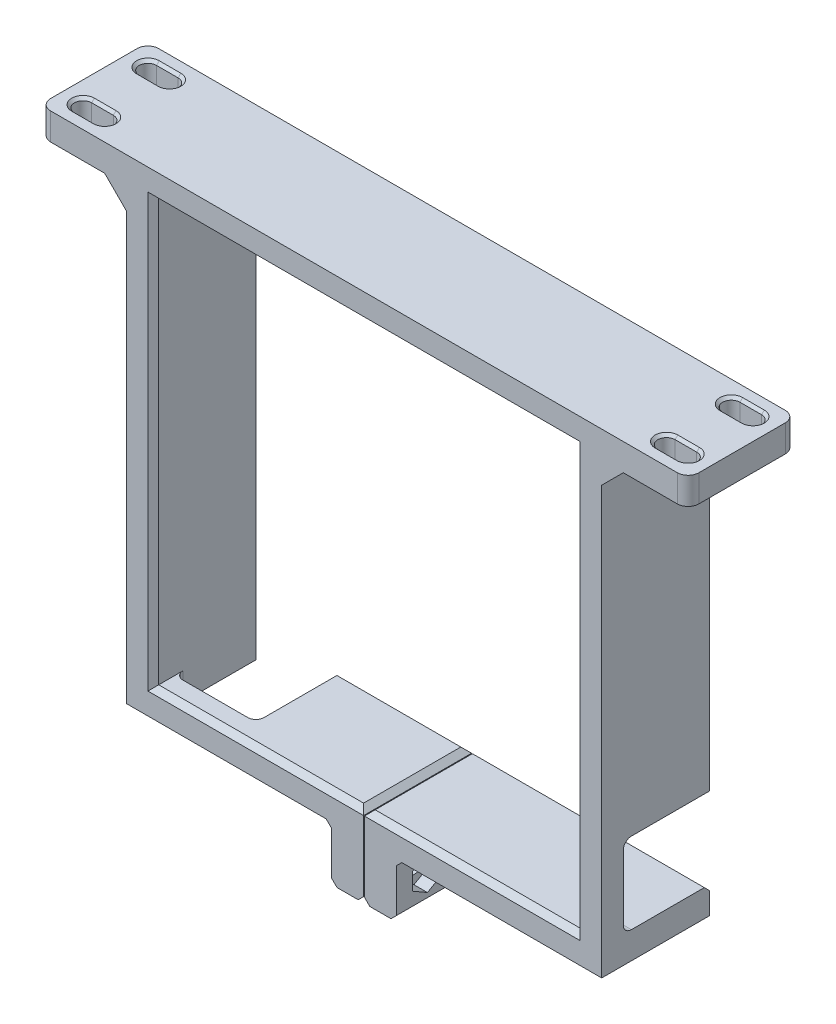
from build123d import *

# Parameters (mm, degrees)
SKETCH1_W            = 88.03
SKETCH1_H            = 88.03
SKETCH1_W_2          = 78.03
SKETCH1_H_2          = 78.03
BOSS_EXTRUDE1_DEPTH  = 20
SKETCH2_W            = 16
SKETCH2_H            = 15
CUT_EXTRUDE1_DEPTH   = 20
SKETCH5_W            = 12
SKETCH5_H            = 10
BOSS_EXTRUDE2_DEPTH  = 20
SKETCH3_W            = 0.15
SKETCH3_H            = 15
CUT_EXTRUDE2_DEPTH   = 73.490968058
CUT_EXTRUDE3_DEPTH   = 2.5
SKETCH7_R            = 1.55
CUT_EXTRUDE4_DEPTH   = 77.283159675
SKETCH8_W            = 16
SKETCH8_H            = 5
BOSS_EXTRUDE3_DEPTH  = 20
CUT_EXTRUDE5_DEPTH   = 117.669109558
FILLET8_R            = 2
FILLET8_OF_MIRROR9_R = 2
CHAMFER1_SIZE        = 4
SKETCH10_W           = 15
SKETCH10_H           = 16
CUT_EXTRUDE6_DEPTH   = 15
FILLET7_R            = 1.5
CHAMFER2_SIZE        = 1
CHAMFER3_SIZE        = 0.5


with BuildPart() as part:
    # Sketch1 → Boss-Extrude1 (new body)
    with BuildSketch(Plane.XY):
        Rectangle(SKETCH1_W, SKETCH1_H)
        Rectangle(SKETCH1_W_2, SKETCH1_H_2, mode=Mode.SUBTRACT)
    extrude(amount=BOSS_EXTRUDE1_DEPTH)

    # Sketch2 → Cut-Extrude1 (cut)
    with BuildSketch(Plane(origin=(44.015, 0, 0), x_dir=(0, 0, -1), z_dir=(1, 0, 0))):
        with Locations((-8, -31.515)):
            Rectangle(SKETCH2_W, SKETCH2_H)
    extrude(amount=-CUT_EXTRUDE1_DEPTH, mode=Mode.SUBTRACT)

    # Sketch5 → Boss-Extrude2 (add)
    with BuildSketch(Plane(origin=(0, 0, 0), x_dir=(-1, 0, 0), z_dir=(0, 0, -1))):
        with Locations((0, -49.015)):
            Rectangle(SKETCH5_W, SKETCH5_H)
    extrude(amount=-BOSS_EXTRUDE2_DEPTH)

    # Sketch3 → Cut-Extrude2 (cut, through all)
    with BuildSketch(Plane(origin=(0, 0, 0), x_dir=(-1, 0, 0), z_dir=(0, 0, -1))):
        with Locations((0, -46.515)):
            Rectangle(SKETCH3_W, SKETCH3_H)
    extrude(amount=-CUT_EXTRUDE2_DEPTH, mode=Mode.SUBTRACT)

    # Sketch6 → Cut-Extrude3 (cut)
    with BuildSketch(Plane.ZY.offset(6)):
        Polygon((8.5, -47.42728676), (5.75, -45.839573519), (3, -47.42728676), (3, -50.60271324), (5.75, -52.190426481), (8.5, -50.60271324), align=None)
        Polygon((17, -47.42728676), (14.25, -45.839573519), (11.5, -47.42728676), (11.5, -50.60271324), (14.25, -52.190426481), (17, -50.60271324), align=None)
    cut_extrude3 = extrude(amount=-CUT_EXTRUDE3_DEPTH, mode=Mode.SUBTRACT)

    # Sketch7 → Cut-Extrude4 (cut, symmetric)
    with BuildSketch(Plane.ZY.offset(6)):
        with Locations(Location((5.75, -49.015, 0), (0, 0, 270))):
            Circle(SKETCH7_R)
        with Locations(Location((14.25, -49.015, 0), (0, 0, 270))):
            Circle(SKETCH7_R)
    cut_extrude4 = extrude(amount=CUT_EXTRUDE4_DEPTH, both=True, mode=Mode.SUBTRACT)

    # Sketch8 → Boss-Extrude3 (add)
    with BuildSketch(Plane(origin=(0, 0, 0), x_dir=(-1, 0, 0), z_dir=(0, 0, -1))):
        with Locations((-52.015, 41.515)):
            Rectangle(SKETCH8_W, SKETCH8_H)
    boss_extrude3 = extrude(amount=-BOSS_EXTRUDE3_DEPTH)

    # Sketch9 → Cut-Extrude5 (cut, through all)
    with BuildSketch(Plane(origin=(0, 44.015, 0), x_dir=(1, 0, 0), z_dir=(0, 1, 0))):
        with BuildLine():
            Line((52.015, -14.4), (56.015, -14.4))
            ThreePointArc((56.015, -14.4), (57.615, -16), (56.015, -17.6))
            Line((56.015, -17.6), (52.015, -17.6))
            ThreePointArc((52.015, -17.6), (50.415, -16), (52.015, -14.4))
        make_face()
        with BuildLine():
            Line((52.015, -2.4), (56.015, -2.4))
            ThreePointArc((56.015, -2.4), (57.615, -4), (56.015, -5.6))
            Line((56.015, -5.6), (52.015, -5.6))
            ThreePointArc((52.015, -5.6), (50.415, -4), (52.015, -2.4))
        make_face()
    cut_extrude5 = extrude(amount=-CUT_EXTRUDE5_DEPTH, mode=Mode.SUBTRACT)

    # Fillet8
    fillet8_edges = [part.edges().sort_by_distance(p)[0] for p in [
        (60.015, 41.515, 0),
        (60.015, 41.515, 20),
    ]]
    fillet(fillet8_edges, radius=FILLET8_R)

    # Mirror9: Cut-Extrude3, Cut-Extrude4, Boss-Extrude3, Cut-Extrude5 across plane
    add(cut_extrude3.mirror(Plane(origin=(0, 0, 0), x_dir=(0, 0, 1), z_dir=(1, 0, 0))), mode=Mode.SUBTRACT)
    add(cut_extrude4.mirror(Plane(origin=(0, 0, 0), x_dir=(0, 0, 1), z_dir=(1, 0, 0))), mode=Mode.SUBTRACT)
    add(boss_extrude3.mirror(Plane(origin=(0, 0, 0), x_dir=(0, 0, 1), z_dir=(1, 0, 0))))
    add(cut_extrude5.mirror(Plane(origin=(0, 0, 0), x_dir=(0, 0, 1), z_dir=(1, 0, 0))), mode=Mode.SUBTRACT)

    # Fillet8 of Mirror9
    fillet8_of_mirror9_edges = [part.edges().sort_by_distance(p)[0] for p in [
        (-60.015, 41.515, 0),
        (-60.015, 41.515, 20),
    ]]
    fillet(fillet8_of_mirror9_edges, radius=FILLET8_OF_MIRROR9_R)

    # Chamfer1
    chamfer1_edges = [part.edges().sort_by_distance(p)[0] for p in [
        (44.015, 39.015, 10),
        (-44.015, 39.015, 10),
    ]]
    chamfer(chamfer1_edges, length=CHAMFER1_SIZE)

    # Sketch10 → Cut-Extrude6 (cut)
    with BuildSketch(Plane.XZ.offset(44.015)):
        with Locations((-31.515, 8)):
            Rectangle(SKETCH10_W, SKETCH10_H)
    extrude(amount=-CUT_EXTRUDE6_DEPTH, mode=Mode.SUBTRACT)

    # Fillet7
    fillet7_edges = [part.edges().sort_by_distance(p)[0] for p in [
        (-39.015, -41.515, 16),
        (-24.015, -41.515, 16),
        (41.515, -39.015, 16),
        (41.515, -24.015, 16),
    ]]
    fillet(fillet7_edges, radius=FILLET7_R)

    # Chamfer2
    chamfer2_edges = [part.edges().sort_by_distance(p)[0] for p in [
        (0, 39.015, 0),
        (-39.015, -2.5, 0),
        (39.015, 0, 20),
        (0, 39.015, 20),
        (-39.015, 0, 20),
        (-19.545, -39.015, 20),
        (39.015, 7.5, 0),
        (-12.045, -39.015, 0),
        (-6, -54.015, 10),
        (-6, -44.015, 10),
        (6, -44.015, 10),
        (6, -54.015, 10),
        (22.045, -39.015, 0),
        (19.545, -39.015, 20),
        (0.075, -54.015, 10),
        (0.075, -39.015, 10),
        (-0.075, -39.015, 10),
        (-0.075, -54.015, 10),
    ]]
    chamfer(chamfer2_edges, length=CHAMFER2_SIZE)

    # Chamfer3
    chamfer3_edges = [part.edges().sort_by_distance(p)[0] for p in [
        (54.015, 39.015, 5.6),
        (57.615, 39.015, 4),
        (54.015, 39.015, 2.4),
        (50.415, 39.015, 4),
        (54.015, 39.015, 17.6),
        (57.615, 39.015, 16),
        (54.015, 39.015, 14.4),
        (50.415, 39.015, 16),
        (50.415, 44.015, 16),
        (54.015, 44.015, 17.6),
        (57.615, 44.015, 16),
        (54.015, 44.015, 14.4),
        (50.415, 44.015, 4),
        (54.015, 44.015, 5.6),
        (57.615, 44.015, 4),
        (54.015, 44.015, 2.4),
        (-54.015, 39.015, 2.4),
        (-57.615, 39.015, 4),
        (-54.015, 39.015, 5.6),
        (-50.415, 39.015, 4),
        (-54.015, 39.015, 14.4),
        (-57.615, 39.015, 16),
        (-54.015, 39.015, 17.6),
        (-50.415, 39.015, 16),
        (-50.415, 44.015, 16),
        (-54.015, 44.015, 17.6),
        (-57.615, 44.015, 16),
        (-54.015, 44.015, 14.4),
        (-50.415, 44.015, 4),
        (-54.015, 44.015, 5.6),
        (-57.615, 44.015, 4),
        (-54.015, 44.015, 2.4),
    ]]
    chamfer(chamfer3_edges, length=CHAMFER3_SIZE)


solid = part.part
